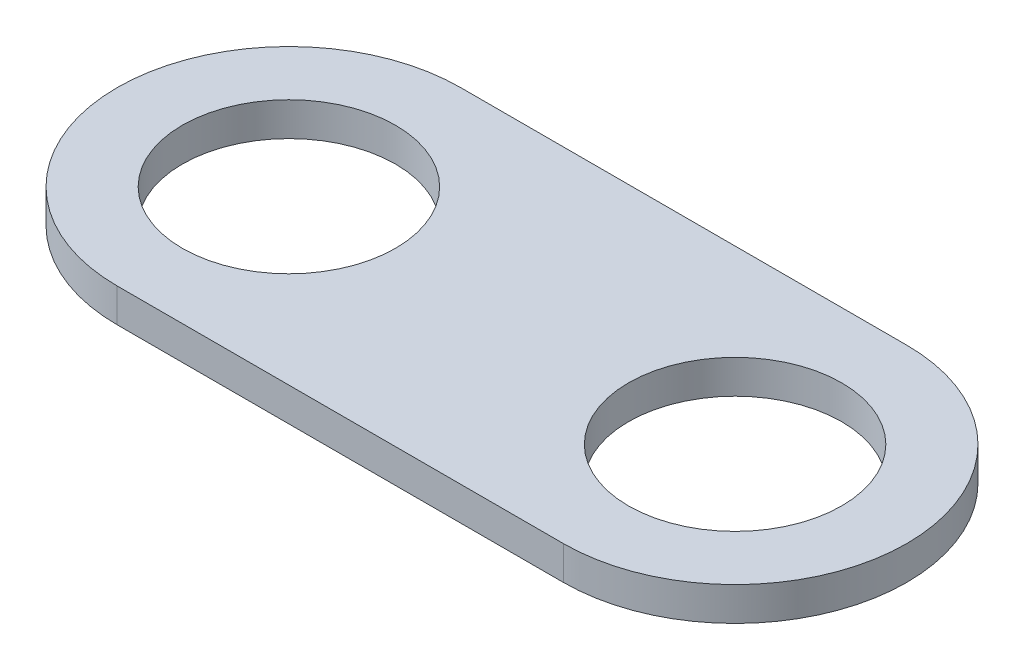
from build123d import *

# Parameters (mm, degrees)
BOSS_EXTRUDE1_DEPTH = 3
SKETCH2_R           = 9.5
CUT_EXTRUDE1_DEPTH  = 47.732818672


with BuildPart() as part:
    # Sketch1 → Boss-Extrude1 (new body)
    with BuildSketch(Plane(origin=(0, 0, 0), x_dir=(1, 0, 0), z_dir=(0, 1, 0))):
        with BuildLine():
            Line((19.879152095, 0), (-19.879152095, 0))
            ThreePointArc((-19.879152095, 0), (-35.184461635, -15.30530954), (-19.879152095, -30.61061908))
            Line((-19.879152095, -30.61061908), (19.879152095, -30.61061908))
            ThreePointArc((19.879152095, -30.61061908), (35.184461635, -15.30530954), (19.879152095, 0))
        make_face()
    extrude(amount=BOSS_EXTRUDE1_DEPTH)

    # Sketch2 → Cut-Extrude1 (cut, through all)
    with BuildSketch(Plane(origin=(0, 3, 0), x_dir=(1, 0, 0), z_dir=(0, 1, 0))):
        with Locations(Location((-19.879152095, -15.30530954, 0), (0, 0, 270))):
            Circle(SKETCH2_R)
        with Locations(Location((19.879152095, -15.30530954, 0), (0, 0, 90))):
            Circle(SKETCH2_R)
    extrude(amount=-CUT_EXTRUDE1_DEPTH, mode=Mode.SUBTRACT)


solid = part.part
